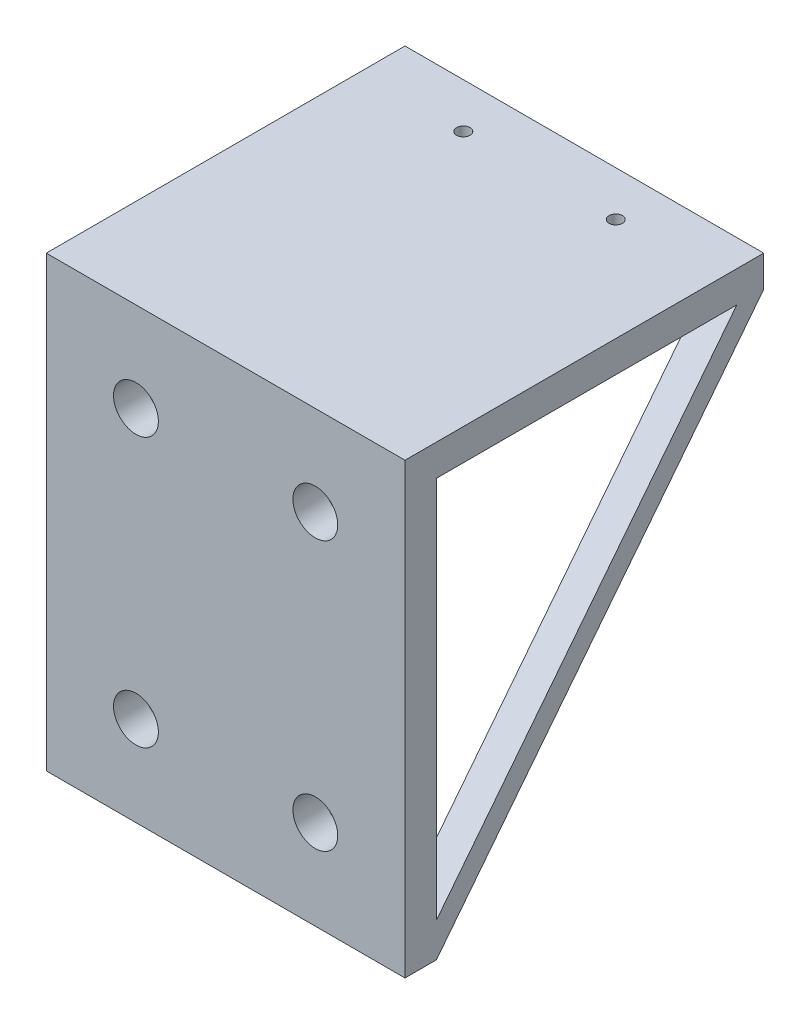
from build123d import *

# Parameters (mm, degrees)
SKETCH1_W           = 80
SKETCH1_H           = 100
BOSS_EXTRUDE1_DEPTH = 7
SKETCH2_R           = 5
CUT_EXTRUDE1_DEPTH  = 7
SKETCH4_W           = 80
SKETCH4_H           = 80
BOSS_EXTRUDE2_DEPTH = 7
BOSS_EXTRUDE4_DEPTH = 7
SKETCH6_R           = 1.5
CUT_EXTRUDE2_DEPTH  = 7


with BuildPart() as part:
    # Sketch1 → Boss-Extrude1 (new body)
    with BuildSketch(Plane.XY):
        Rectangle(SKETCH1_W, SKETCH1_H)
    extrude(amount=BOSS_EXTRUDE1_DEPTH)

    # Sketch2 → Cut-Extrude1 (cut)
    with BuildSketch(Plane(origin=(0, 0, 0), x_dir=(-1, 0, 0), z_dir=(0, 0, -1))):
        with Locations((-20, 30)):
            Circle(SKETCH2_R)
        with Locations((20, 30)):
            Circle(SKETCH2_R)
        with Locations((20, -30)):
            Circle(SKETCH2_R)
        with Locations((-20, -30)):
            Circle(SKETCH2_R)
    extrude(amount=-CUT_EXTRUDE1_DEPTH, mode=Mode.SUBTRACT)

    # Sketch4 → Boss-Extrude2 (add)
    with BuildSketch(Plane(origin=(0, 50, 0), x_dir=(1, 0, 0), z_dir=(0, 1, 0))):
        with Locations((0, 33)):
            Rectangle(SKETCH4_W, SKETCH4_H)
    extrude(amount=-BOSS_EXTRUDE2_DEPTH)

    # Sketch5 → Boss-Extrude4 (add)
    with BuildSketch(Plane(origin=(40, 0, 0), x_dir=(0, 0, -1), z_dir=(1, 0, 0))):
        Polygon((0, -50), (73, 43), (67, 43), (-6, -50), align=None)
    boss_extrude4 = extrude(amount=-BOSS_EXTRUDE4_DEPTH)

    # Mirror3: Boss-Extrude4 across plane
    add(boss_extrude4.mirror(Plane(origin=(0, 0, 0), x_dir=(0, 0, 1), z_dir=(1, 0, 0))))

    # Sketch6 → Cut-Extrude2 (cut)
    with BuildSketch(Plane(origin=(0, 50, 0), x_dir=(1, 0, 0), z_dir=(0, 1, 0))):
        with Locations(Location((-17, 63, 0), (0, 0, 180))):
            Circle(SKETCH6_R)
        with Locations(Location((17, 63, 0), (0, 0, 180))):
            Circle(SKETCH6_R)
    extrude(amount=-CUT_EXTRUDE2_DEPTH, mode=Mode.SUBTRACT)


solid = part.part
